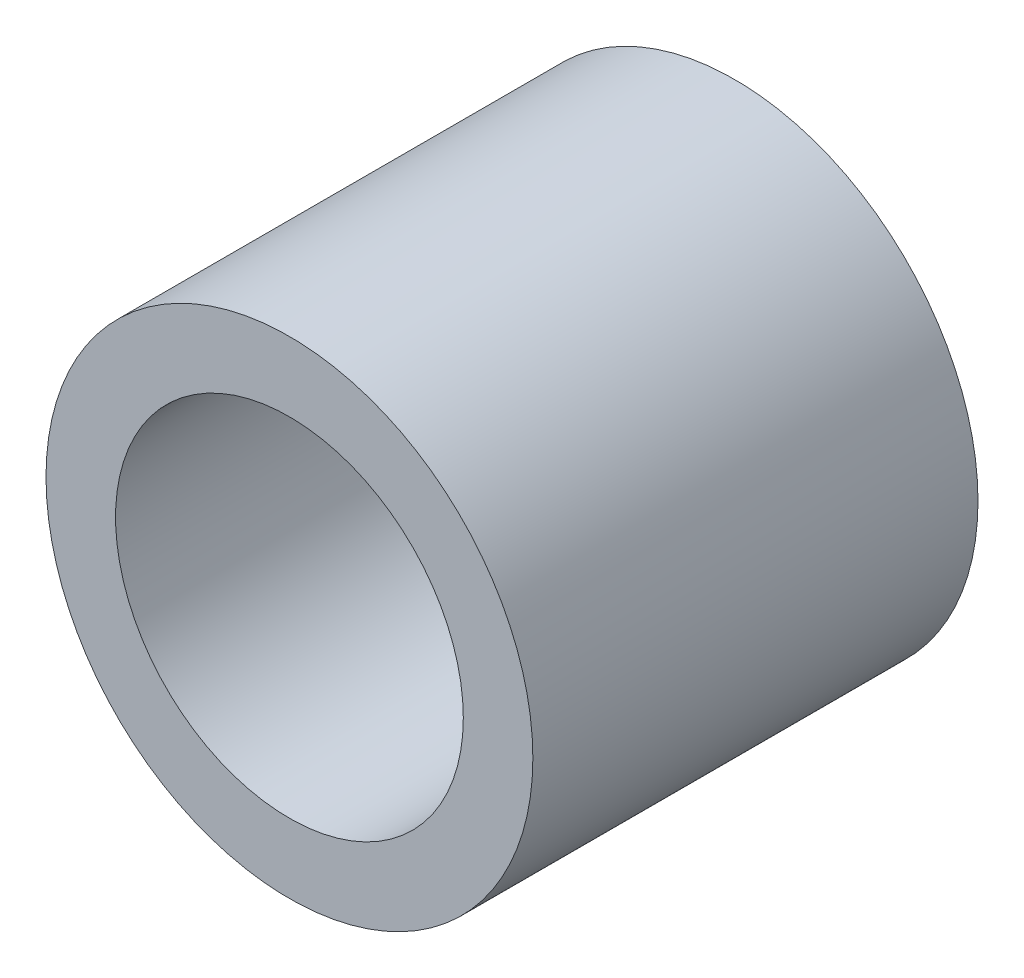
from build123d import *

# Parameters (mm, degrees)
SKETCH1_R           = 11.1125
SKETCH1_R_2         = 7.9375
BOSS_EXTRUDE1_DEPTH = 20.32


with BuildPart() as part:
    # Sketch1 → Boss-Extrude1 (new body)
    with BuildSketch(Plane(origin=(0, 0, 0), x_dir=(0, 1, 0), z_dir=(0, 0, 1))):
        with Locations(Location((0, 0, 0), (0, 0, 270))):
            Circle(SKETCH1_R)
        with Locations(Location((0, 0, 0), (0, 0, 270))):
            Circle(SKETCH1_R_2, mode=Mode.SUBTRACT)
    extrude(amount=BOSS_EXTRUDE1_DEPTH)


solid = part.part
